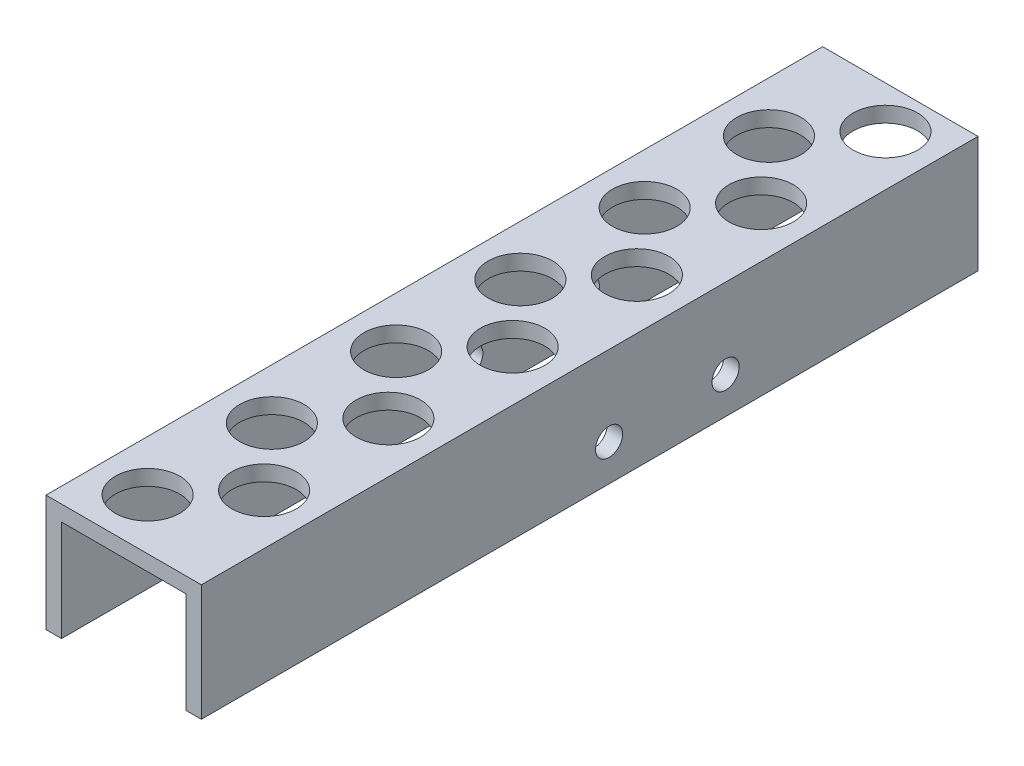
from build123d import *

# Parameters (mm, degrees)
CROQUIS1_W                 = 20
CROQUIS1_H                 = 15
SALIENTE_EXTRUIR1_DEPTH    = 100
CROQUIS2_W                 = 16
CROQUIS2_H                 = 13
CORTAR_EXTRUIR2_DEPTH      = 100
CROQUIS3_R                 = 4.15
CORTAR_EXTRUIR3_DEPTH      = 2
CORTAR_EXTRUIR5_DEPTH      = 103.255806681
CORTAR_EXTRUIR5_DEPTH_BACK = 103.255806681
CROQUIS4_R                 = 1.75


with BuildPart() as part:
    # Croquis1 → Saliente-Extruir1 (new body)
    with BuildSketch(Plane.XY):
        Rectangle(CROQUIS1_W, CROQUIS1_H)
    extrude(amount=SALIENTE_EXTRUIR1_DEPTH)

    # Croquis2 → Cortar-Extruir2 (cut)
    with BuildSketch(Plane(origin=(0, 0, 0), x_dir=(-1, 0, 0), z_dir=(0, 0, -1))):
        with Locations((0, -1)):
            Rectangle(CROQUIS2_W, CROQUIS2_H)
    extrude(amount=-CORTAR_EXTRUIR2_DEPTH, mode=Mode.SUBTRACT)

    # Croquis3 → Cortar-Extruir3 (cut)
    with BuildSketch(Plane(origin=(0, 7.5, 0), x_dir=(1, 0, 0), z_dir=(0, 1, 0))):
        with Locations(Location((3.5, -5.419128069, 0), (0, 0, 270))):
            Circle(CROQUIS3_R)
        with Locations(Location((-3.5, -13.419128069, 0), (0, 0, 270))):
            Circle(CROQUIS3_R)
        with Locations(Location((3.5, -21.419128069, 0), (0, 0, 270))):
            Circle(CROQUIS3_R)
        with Locations(Location((-3.5, -29.419128069, 0), (0, 0, 270))):
            Circle(CROQUIS3_R)
        with Locations(Location((3.5, -37.419128069, 0), (0, 0, 270))):
            Circle(CROQUIS3_R)
        with Locations(Location((-3.5, -45.419128069, 0), (0, 0, 270))):
            Circle(CROQUIS3_R)
        with Locations(Location((3.5, -53.419128069, 0), (0, 0, 270))):
            Circle(CROQUIS3_R)
        with Locations(Location((-3.5, -61.419128069, 0), (0, 0, 270))):
            Circle(CROQUIS3_R)
        with Locations(Location((3.5, -69.419128069, 0), (0, 0, 270))):
            Circle(CROQUIS3_R)
        with Locations(Location((-3.5, -77.419128069, 0), (0, 0, 270))):
            Circle(CROQUIS3_R)
        with Locations(Location((3.5, -85.419128069, 0), (0, 0, 270))):
            Circle(CROQUIS3_R)
        with Locations(Location((-3.5, -93.419128069, 0), (0, 0, 270))):
            Circle(CROQUIS3_R)
    extrude(amount=-CORTAR_EXTRUIR3_DEPTH, mode=Mode.SUBTRACT)

    # Croquis4 → Cortar-Extruir5 (cut, two sides: drawn at the far end of the back side and taken through both)
    with BuildSketch(Plane(origin=(10, 0, 0), x_dir=(0, 0, -1), z_dir=(1, 0, 0)).offset(-CORTAR_EXTRUIR5_DEPTH_BACK)):
        with Locations((-32.5, -2.8)):
            Circle(CROQUIS4_R)
        with Locations((-47.5, -2.8)):
            Circle(CROQUIS4_R)
    extrude(amount=CORTAR_EXTRUIR5_DEPTH + CORTAR_EXTRUIR5_DEPTH_BACK, mode=Mode.SUBTRACT)


solid = part.part
